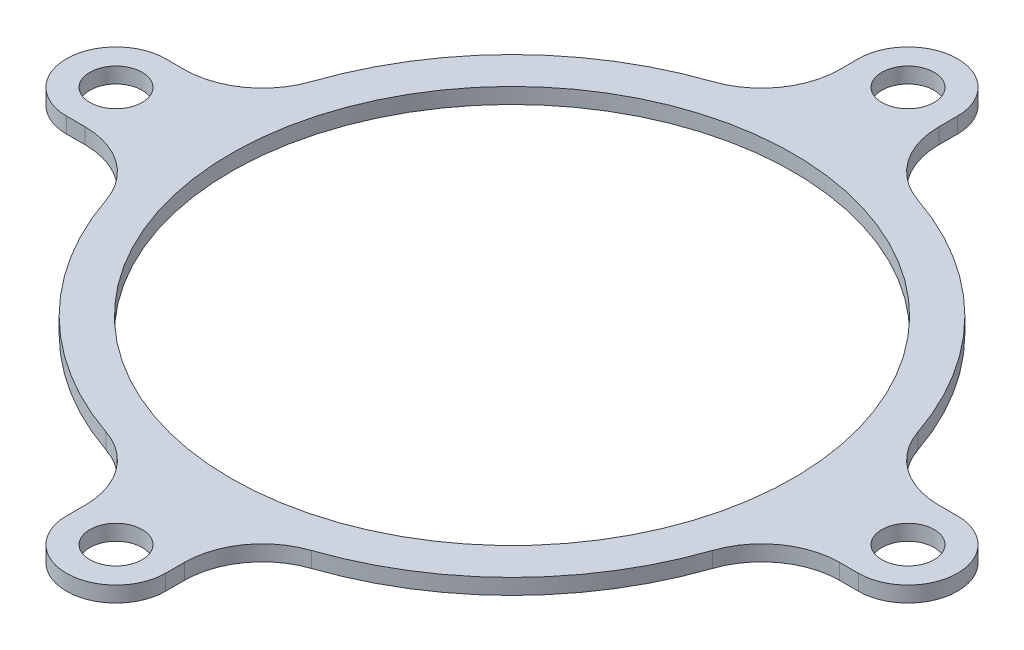
from build123d import *

# Parameters (mm, degrees)
SKETCH1_R           = 41
SKETCH1_R_2         = 36
BOSS_EXTRUDE1_DEPTH = 1
SKETCH2_R           = 3.35
BOSS_EXTRUDE2_DEPTH = 2
CIRPATTERN1_COUNT   = 4


with BuildPart() as part:
    # Sketch1 → Boss-Extrude1 (new, symmetric)
    with BuildSketch(Plane(origin=(0, 0, 0), x_dir=(1, 0, 0), z_dir=(0, 1, 0))):
        with Locations(Location((0, 0, 0), (0, 0, 270))):
            Circle(SKETCH1_R)
        with Locations(Location((0, 0, 0), (0, 0, 270))):
            Circle(SKETCH1_R_2, mode=Mode.SUBTRACT)
    extrude(amount=BOSS_EXTRUDE1_DEPTH, both=True)

    # Sketch2 → Boss-Extrude2 (add)
    with BuildSketch(Plane(origin=(0, 1, 0), x_dir=(1, 0, 0), z_dir=(0, 1, 0))):
        with BuildLine():
            Line((-6.35, 48.308151486), (-6.35, 50.7))
            ThreePointArc((-6.35, 50.7), (0, 57.05), (6.35, 50.7))
            Line((6.35, 50.7), (6.35, 48.308151486))
            ThreePointArc((6.35, 48.308151486), (8.224151628, 42.479722175), (13.144117647, 38.83596492))
            ThreePointArc((13.144117647, 38.83596492), (0, 41), (-13.144117647, 38.83596492))
            ThreePointArc((-13.144117647, 38.83596492), (-8.224151628, 42.479722175), (-6.35, 48.308151486))
        make_face()
        with Locations(Location((0, 50.7, 0), (0, 0, 270))):
            Circle(SKETCH2_R, mode=Mode.SUBTRACT)
    boss_extrude2 = extrude(amount=-BOSS_EXTRUDE2_DEPTH)

    # CirPattern1: Boss-Extrude2 ×4 about axis
    cirpattern1_axis = Axis((0, 0, 0), (0, 1, 0))
    for i in range(1, CIRPATTERN1_COUNT):
        add(boss_extrude2.rotate(cirpattern1_axis, i * 360 / CIRPATTERN1_COUNT))


solid = part.part
